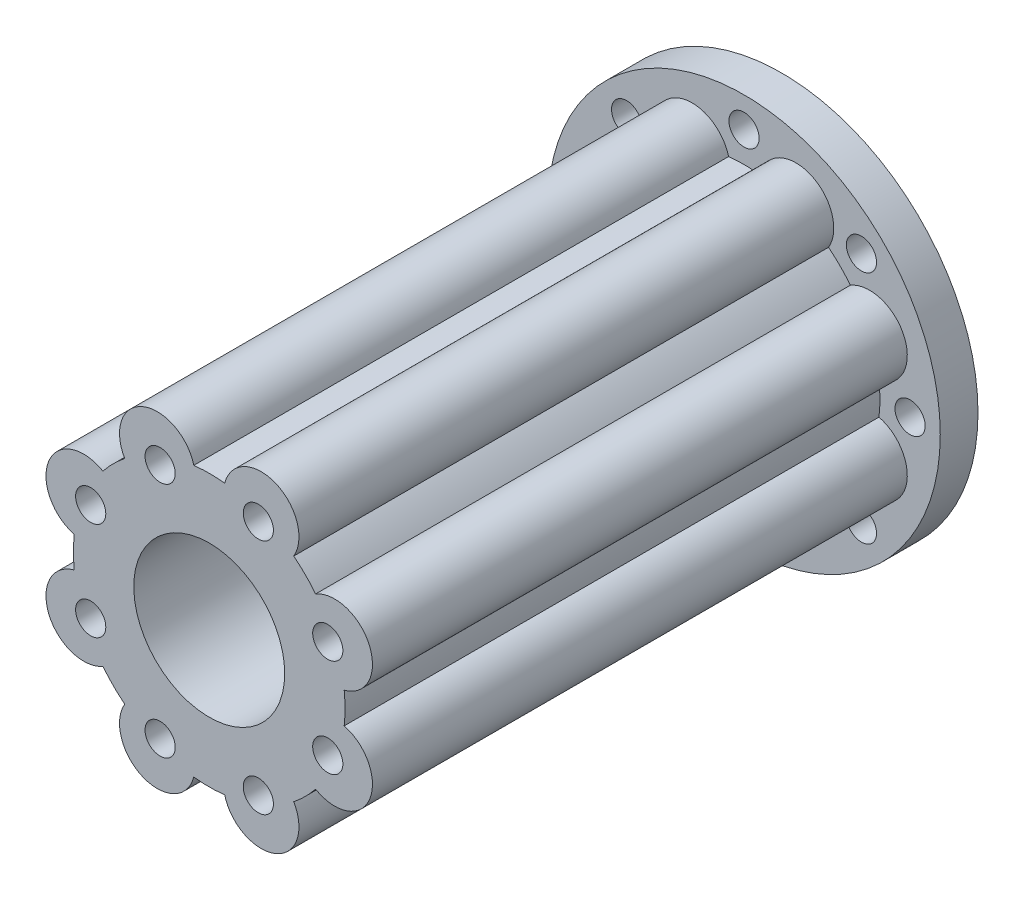
from build123d import *

# Parameters (mm, degrees)
CROQUIS1_R              = 13
CROQUIS1_R_2            = 1
SALIENTE_EXTRUIR1_DEPTH = 2.5
CROQUIS2_R              = 5
CORTAR_EXTRUIR2_DEPTH   = 2.5
SALIENTE_EXTRUIR2_START = 35.430987392
CROQUIS3_R              = 9
CROQUIS3_R_2            = 5
SALIENTE_EXTRUIR2_DEPTH = 35.430987392
SALIENTE_EXTRUIR3_REACH = 44.152
CROQUIS4_R              = 2.5
CROQUIS5_R              = 1
CORTAR_EXTRUIR3_DEPTH   = 10


with BuildPart() as part:
    # Croquis1 → Saliente-Extruir1 (new body)
    with BuildSketch(Plane.XY):
        Circle(CROQUIS1_R)
        with Locations((0, 11)):
            Circle(CROQUIS1_R_2, mode=Mode.SUBTRACT)
        with Locations((7.778174593, 7.778174593)):
            Circle(CROQUIS1_R_2, mode=Mode.SUBTRACT)
        with Locations((11, 0)):
            Circle(CROQUIS1_R_2, mode=Mode.SUBTRACT)
        with Locations((7.778174593, -7.778174593)):
            Circle(CROQUIS1_R_2, mode=Mode.SUBTRACT)
        with Locations((0, -11)):
            Circle(CROQUIS1_R_2, mode=Mode.SUBTRACT)
        with Locations((-7.778174593, -7.778174593)):
            Circle(CROQUIS1_R_2, mode=Mode.SUBTRACT)
        with Locations((-11, 0)):
            Circle(CROQUIS1_R_2, mode=Mode.SUBTRACT)
        with Locations((-7.778174593, 7.778174593)):
            Circle(CROQUIS1_R_2, mode=Mode.SUBTRACT)
    extrude(amount=SALIENTE_EXTRUIR1_DEPTH)

    # Croquis2 → Cortar-Extruir2 (cut)
    with BuildSketch(Plane.XY.offset(2.5)):
        Circle(CROQUIS2_R)
    extrude(amount=-CORTAR_EXTRUIR2_DEPTH, mode=Mode.SUBTRACT)

    # Croquis3 → Saliente-Extruir2 (add)
    with BuildSketch(Plane.XY.offset(2.5).offset(SALIENTE_EXTRUIR2_START)):
        with Locations(Location((0, 0, 0), (0, 0, 180))):
            Circle(CROQUIS3_R)
        Circle(CROQUIS3_R_2, mode=Mode.SUBTRACT)
    extrude(amount=-SALIENTE_EXTRUIR2_DEPTH)

    # Croquis4 → Saliente-Extruir3 (add, up to next)
    with BuildSketch(Plane.XY.offset(37.930987392), mode=Mode.PRIVATE) as saliente_extruir3_sk1:
        with Locations((3.444150891, 8.314915793)):
            Circle(CROQUIS4_R)
    saliente_extruir3_tool1 = extrude(saliente_extruir3_sk1.sketch, amount=-SALIENTE_EXTRUIR3_REACH, mode=Mode.PRIVATE) - part.part
    # Croquis4 → Saliente-Extruir3 (add, up to next)
    with BuildSketch(Plane.XY.offset(37.930987392), mode=Mode.PRIVATE) as saliente_extruir3_sk2:
        with Locations((8.314915793, 3.444150891)):
            Circle(CROQUIS4_R)
    saliente_extruir3_tool2 = extrude(saliente_extruir3_sk2.sketch, amount=-SALIENTE_EXTRUIR3_REACH, mode=Mode.PRIVATE) - part.part
    # Croquis4 → Saliente-Extruir3 (add, up to next)
    with BuildSketch(Plane.XY.offset(37.930987392), mode=Mode.PRIVATE) as saliente_extruir3_sk3:
        with Locations((8.314915793, -3.444150891)):
            Circle(CROQUIS4_R)
    saliente_extruir3_tool3 = extrude(saliente_extruir3_sk3.sketch, amount=-SALIENTE_EXTRUIR3_REACH, mode=Mode.PRIVATE) - part.part
    # Croquis4 → Saliente-Extruir3 (add, up to next)
    with BuildSketch(Plane.XY.offset(37.930987392), mode=Mode.PRIVATE) as saliente_extruir3_sk4:
        with Locations((3.444150891, -8.314915793)):
            Circle(CROQUIS4_R)
    saliente_extruir3_tool4 = extrude(saliente_extruir3_sk4.sketch, amount=-SALIENTE_EXTRUIR3_REACH, mode=Mode.PRIVATE) - part.part
    # Croquis4 → Saliente-Extruir3 (add, up to next)
    with BuildSketch(Plane.XY.offset(37.930987392), mode=Mode.PRIVATE) as saliente_extruir3_sk5:
        with Locations((-3.444150891, -8.314915793)):
            Circle(CROQUIS4_R)
    saliente_extruir3_tool5 = extrude(saliente_extruir3_sk5.sketch, amount=-SALIENTE_EXTRUIR3_REACH, mode=Mode.PRIVATE) - part.part
    # Croquis4 → Saliente-Extruir3 (add, up to next)
    with BuildSketch(Plane.XY.offset(37.930987392), mode=Mode.PRIVATE) as saliente_extruir3_sk6:
        with Locations((-8.314915793, -3.444150891)):
            Circle(CROQUIS4_R)
    saliente_extruir3_tool6 = extrude(saliente_extruir3_sk6.sketch, amount=-SALIENTE_EXTRUIR3_REACH, mode=Mode.PRIVATE) - part.part
    # Croquis4 → Saliente-Extruir3 (add, up to next)
    with BuildSketch(Plane.XY.offset(37.930987392), mode=Mode.PRIVATE) as saliente_extruir3_sk7:
        with Locations((-8.314915793, 3.444150891)):
            Circle(CROQUIS4_R)
    saliente_extruir3_tool7 = extrude(saliente_extruir3_sk7.sketch, amount=-SALIENTE_EXTRUIR3_REACH, mode=Mode.PRIVATE) - part.part
    # Croquis4 → Saliente-Extruir3 (add, up to next)
    with BuildSketch(Plane.XY.offset(37.930987392), mode=Mode.PRIVATE) as saliente_extruir3_sk8:
        with Locations((-3.444150891, 8.314915793)):
            Circle(CROQUIS4_R)
    saliente_extruir3_tool8 = extrude(saliente_extruir3_sk8.sketch, amount=-SALIENTE_EXTRUIR3_REACH, mode=Mode.PRIVATE) - part.part
    add(saliente_extruir3_tool1.solids().sort_by_distance((3.444151, 8.314916, 37.930987))[0])
    add(saliente_extruir3_tool2.solids().sort_by_distance((8.314916, 3.444151, 37.930987))[0])
    add(saliente_extruir3_tool3.solids().sort_by_distance((8.314916, -3.444151, 37.930987))[0])
    add(saliente_extruir3_tool4.solids().sort_by_distance((3.444151, -8.314916, 37.930987))[0])
    add(saliente_extruir3_tool5.solids().sort_by_distance((-3.444151, -8.314916, 37.930987))[0])
    add(saliente_extruir3_tool6.solids().sort_by_distance((-8.314916, -3.444151, 37.930987))[0])
    add(saliente_extruir3_tool7.solids().sort_by_distance((-8.314916, 3.444151, 37.930987))[0])
    add(saliente_extruir3_tool8.solids().sort_by_distance((-3.444151, 8.314916, 37.930987))[0])

    # Croquis5 → Cortar-Extruir3 (cut)
    with BuildSketch(Plane.XY.offset(37.930987392)):
        with Locations((-3.252809175, 7.852976026)):
            Circle(CROQUIS5_R)
        with Locations((3.252809175, 7.852976026)):
            Circle(CROQUIS5_R)
        with Locations((7.852976026, 3.252809175)):
            Circle(CROQUIS5_R)
        with Locations((7.852976026, -3.252809175)):
            Circle(CROQUIS5_R)
        with Locations((3.252809175, -7.852976026)):
            Circle(CROQUIS5_R)
        with Locations((-3.252809175, -7.852976026)):
            Circle(CROQUIS5_R)
        with Locations((-7.852976026, -3.252809175)):
            Circle(CROQUIS5_R)
        with Locations((-7.852976026, 3.252809175)):
            Circle(CROQUIS5_R)
    extrude(amount=-CORTAR_EXTRUIR3_DEPTH, mode=Mode.SUBTRACT)


solid = part.part
